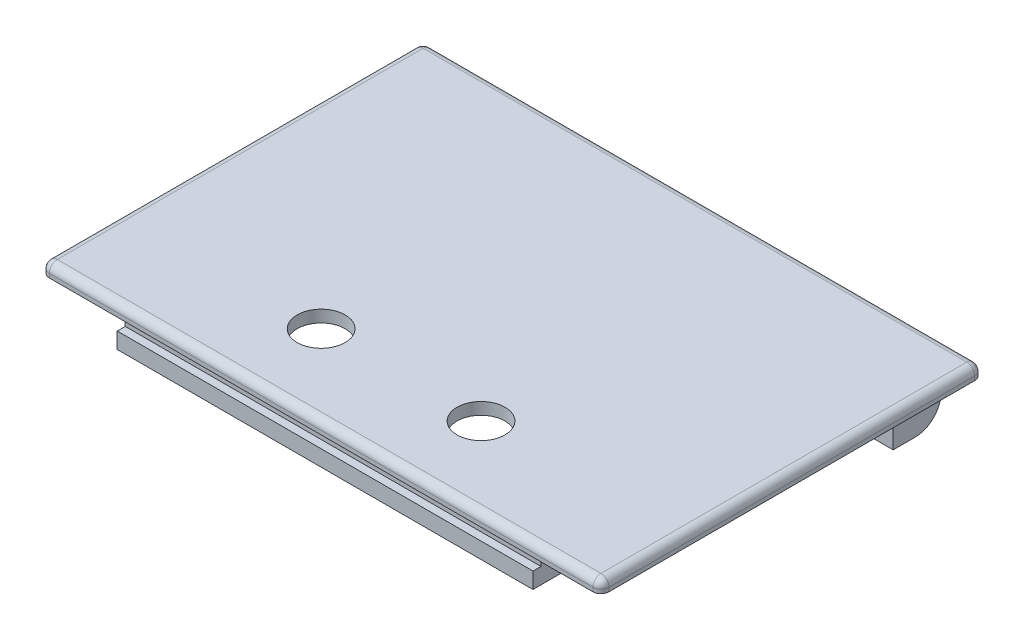
from build123d import *

# Parameters (mm, degrees)
SCHIZZO1_W                   = 140
SCHIZZO1_H                   = 95.5
ESTRUSIONE_ESTRUSIONE1_DEPTH = 3
SCHIZZO2_R                   = 6
TAGLIO_ESTRUSIONE1_DEPTH     = 3
SCHIZZO3_W                   = 104
SCHIZZO3_H                   = 8
ESTRUSIONE_ESTRUSIONE2_DEPTH = 8
TAGLIO_ESTRUSIONE2_DEPTH     = 104
SCHIZZO5_W                   = 9
SCHIZZO5_H                   = 12
ESTRUSIONE_ESTRUSIONE3_DEPTH = 12
RACCORDO1_R                  = 2
RACCORDO2_R                  = 6.5
SCHIZZO6_R                   = 1.7
TAGLIO_ESTRUSIONE3_DEPTH     = 165.012469038
TAGLIO_ESTRUSIONE4_DEPTH     = 2.5
TAGLIO_ESTRUSIONE5_DEPTH     = 2.5


with BuildPart() as part:
    # Schizzo1 → Estrusione-Estrusione1 (new body)
    with BuildSketch(Plane(origin=(0, 0, 0), x_dir=(1, 0, 0), z_dir=(0, 1, 0))):
        with Locations((70, 47.75)):
            Rectangle(SCHIZZO1_W, SCHIZZO1_H)
    extrude(amount=ESTRUSIONE_ESTRUSIONE1_DEPTH)

    # Schizzo2 → Taglio-Estrusione1 (cut)
    with BuildSketch(Plane(origin=(0, 3, 0), x_dir=(1, 0, 0), z_dir=(0, 1, 0))):
        with Locations(Location((50, 20, 0), (0, 0, 270))):
            Circle(SCHIZZO2_R)
        with Locations(Location((90, 20, 0), (0, 0, 270))):
            Circle(SCHIZZO2_R)
    extrude(amount=-TAGLIO_ESTRUSIONE1_DEPTH, mode=Mode.SUBTRACT)

    # Schizzo3 → Estrusione-Estrusione2 (add)
    with BuildSketch(Plane.XZ):
        with Locations((70, -4)):
            Rectangle(SCHIZZO3_W, SCHIZZO3_H)
    extrude(amount=ESTRUSIONE_ESTRUSIONE2_DEPTH)

    # Schizzo4 → Taglio-Estrusione2 (cut)
    with BuildSketch(Plane(origin=(122, 0, 0), x_dir=(0, 0, -1), z_dir=(1, 0, 0))):
        Polygon((0, 0), (0, -8), (1, -8), (1, -4), (3, -4), (3, 0), align=None)
    extrude(amount=-TAGLIO_ESTRUSIONE2_DEPTH, mode=Mode.SUBTRACT)

    # Schizzo5 → Estrusione-Estrusione3 (add)
    with BuildSketch(Plane.XZ):
        with Locations((11.7, -86.3)):
            Rectangle(SCHIZZO5_W, SCHIZZO5_H)
        with Locations((128.3, -86.3)):
            Rectangle(SCHIZZO5_W, SCHIZZO5_H)
    extrude(amount=ESTRUSIONE_ESTRUSIONE3_DEPTH)

    # Raccordo1
    raccordo1_edges = [part.edges().sort_by_distance(p)[0] for p in [
        (140, 3, -47.75),
        (70, 3, -95.5),
        (0, 3, -47.75),
        (0, 1.5, -95.5),
        (140, 1.5, -95.5),
        (140, 1.5, 0),
        (0, 1.5, 0),
        (70, 3, 0),
    ]]
    fillet(raccordo1_edges, radius=RACCORDO1_R)

    # Raccordo2
    raccordo2_edges = [part.edges().sort_by_distance(p)[0] for p in [
        (11.7, -12, -92.3),
        (128.3, -12, -92.3),
    ]]
    fillet(raccordo2_edges, radius=RACCORDO2_R)

    # Schizzo6 → Taglio-Estrusione3 (cut, through all)
    with BuildSketch(Plane.ZY.offset(-7.2)):
        with Locations((-87.5, -5)):
            Circle(SCHIZZO6_R)
    extrude(amount=-TAGLIO_ESTRUSIONE3_DEPTH, mode=Mode.SUBTRACT)

    # Schizzo7 → Taglio-Estrusione4 (cut)
    with BuildSketch(Plane.ZY.offset(-123.8)):
        Polygon((-90.35, -6.645448267), (-87.5, -8.290896534), (-84.65, -6.645448267), (-84.65, -3.354551733), (-87.5, -1.709103466), (-90.35, -3.354551733), align=None)
    extrude(amount=-TAGLIO_ESTRUSIONE4_DEPTH, mode=Mode.SUBTRACT)

    # Schizzo8 → Taglio-Estrusione5 (cut)
    with BuildSketch(Plane(origin=(16.2, 0, 0), x_dir=(0, 0, -1), z_dir=(1, 0, 0))):
        Polygon((84.65, -6.645448267), (87.5, -8.290896534), (90.35, -6.645448267), (90.35, -3.354551733), (87.5, -1.709103466), (84.65, -3.354551733), align=None)
    extrude(amount=-TAGLIO_ESTRUSIONE5_DEPTH, mode=Mode.SUBTRACT)


solid = part.part
